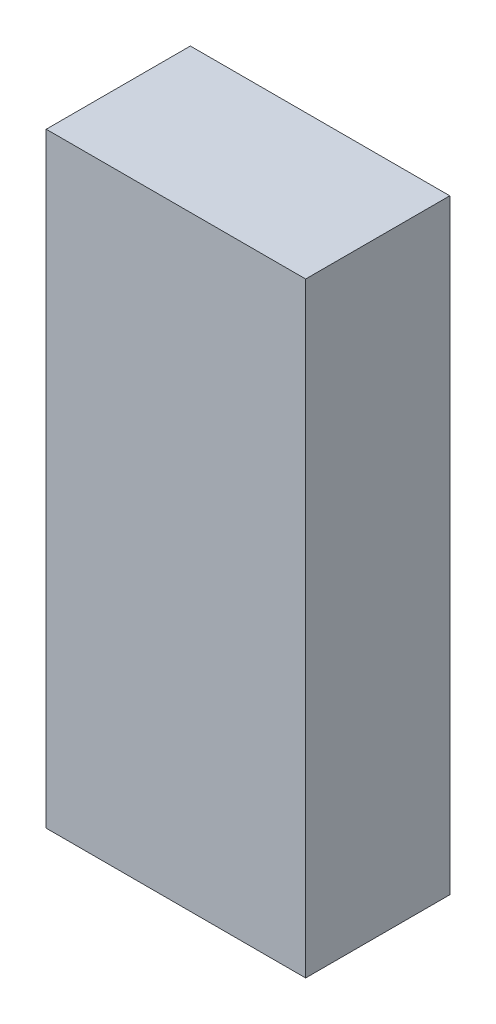
from build123d import *

# Parameters (mm, degrees)
SKETCH1_W           = 0.45
SKETCH1_H           = 1.05
BOSS_EXTRUDE1_DEPTH = 0.25


with BuildPart() as part:
    # Sketch1 → Boss-Extrude1 (new body)
    with BuildSketch(Plane.XY):
        Rectangle(SKETCH1_W, SKETCH1_H)
    extrude(amount=BOSS_EXTRUDE1_DEPTH)


solid = part.part
